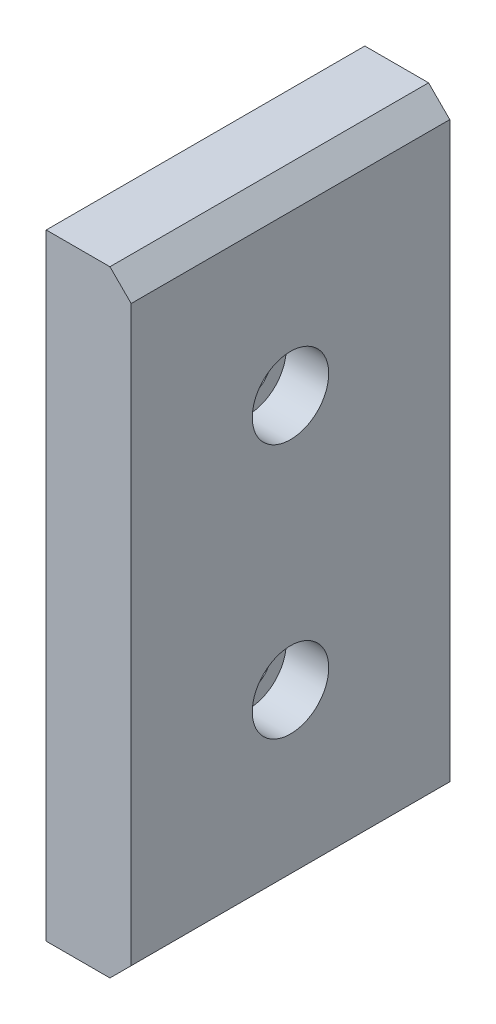
from build123d import *

# Parameters (mm, degrees)
SKETCH_1_W          = 15
SKETCH_1_H          = 29
SKETCH_1_R          = 1.1
EXTRUDE_1_DEPTH     = 4
SKETCH_2_R          = 1.8
CUT_EXTRUDE_1_DEPTH = 2
CHAMFER_1_SIZE      = 1


with BuildPart() as part:
    # Эскиз1 → Бобышка-Вытянуть1 (new body)
    with BuildSketch(Plane(origin=(0, 0, 0), x_dir=(0, 0, -1), z_dir=(1, 0, 0))):
        Rectangle(SKETCH_1_W, SKETCH_1_H)
        with Locations((0, 6)):
            Circle(SKETCH_1_R, mode=Mode.SUBTRACT)
        with Locations(Location((0, -6, 0), (0, 0, 180))):
            Circle(SKETCH_1_R, mode=Mode.SUBTRACT)
    extrude(amount=EXTRUDE_1_DEPTH)

    # Эскиз2 → Вырез-Вытянуть1 (cut)
    with BuildSketch(Plane(origin=(4, 0, 0), x_dir=(0, 0, -1), z_dir=(1, 0, 0))):
        with Locations((0, 6)):
            Circle(SKETCH_2_R)
        with Locations((0, -6)):
            Circle(SKETCH_2_R)
    extrude(amount=-CUT_EXTRUDE_1_DEPTH, mode=Mode.SUBTRACT)

    # Фаска1
    chamfer_1_edges = [part.edges().sort_by_distance(p)[0] for p in [
        (4, -14.5, 0),
        (4, 14.5, 0),
    ]]
    chamfer(chamfer_1_edges, length=CHAMFER_1_SIZE)


solid = part.part
